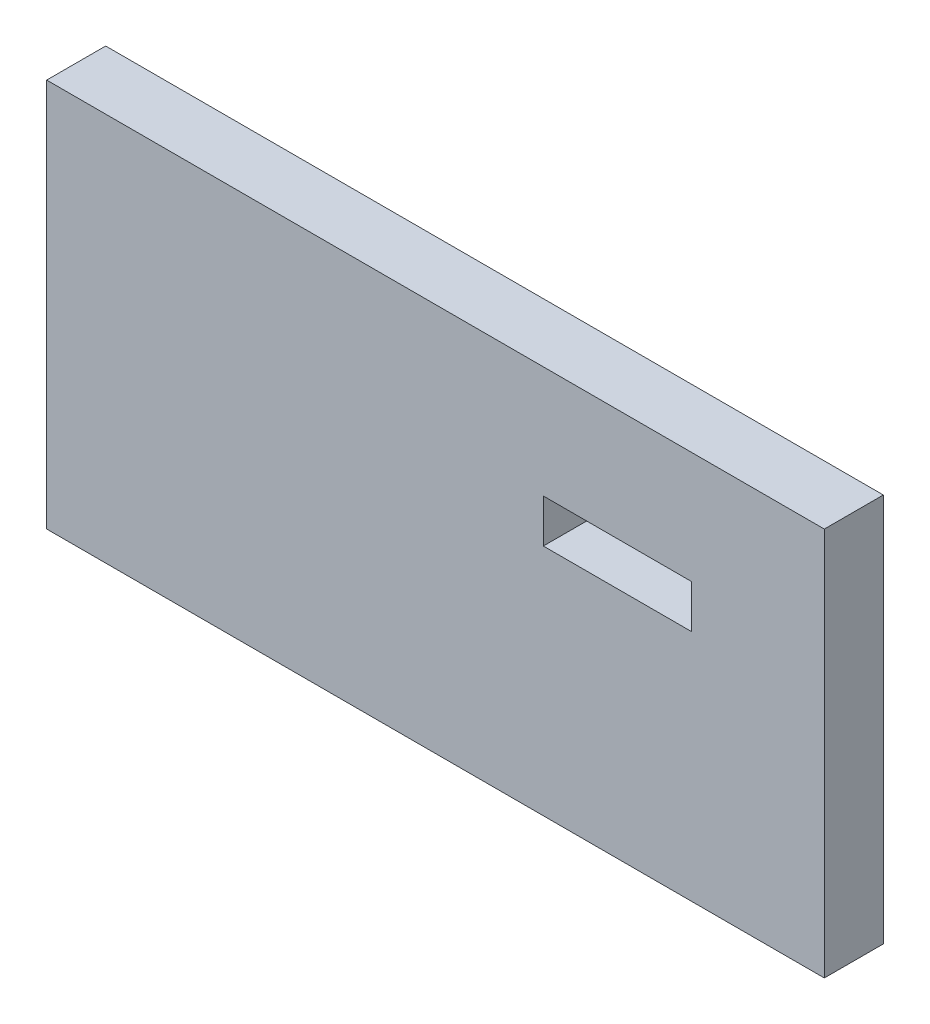
from build123d import *

# Parameters (mm, degrees)
SKETCH1_W           = 131.78232807
SKETCH1_H           = 65.891164035
SKETCH1_W_2         = 25.122990279
SKETCH1_H_2         = 7.346433981
BOSS_EXTRUDE1_DEPTH = 10


with BuildPart() as part:
    # Sketch1 → Boss-Extrude1 (new body)
    with BuildSketch(Plane.XY):
        with Locations((65.891164035, 32.945582018)):
            Rectangle(SKETCH1_W, SKETCH1_H)
        with Locations((96.72804741, 43.262333441)):
            Rectangle(SKETCH1_W_2, SKETCH1_H_2, mode=Mode.SUBTRACT)
    extrude(amount=BOSS_EXTRUDE1_DEPTH)


solid = part.part
